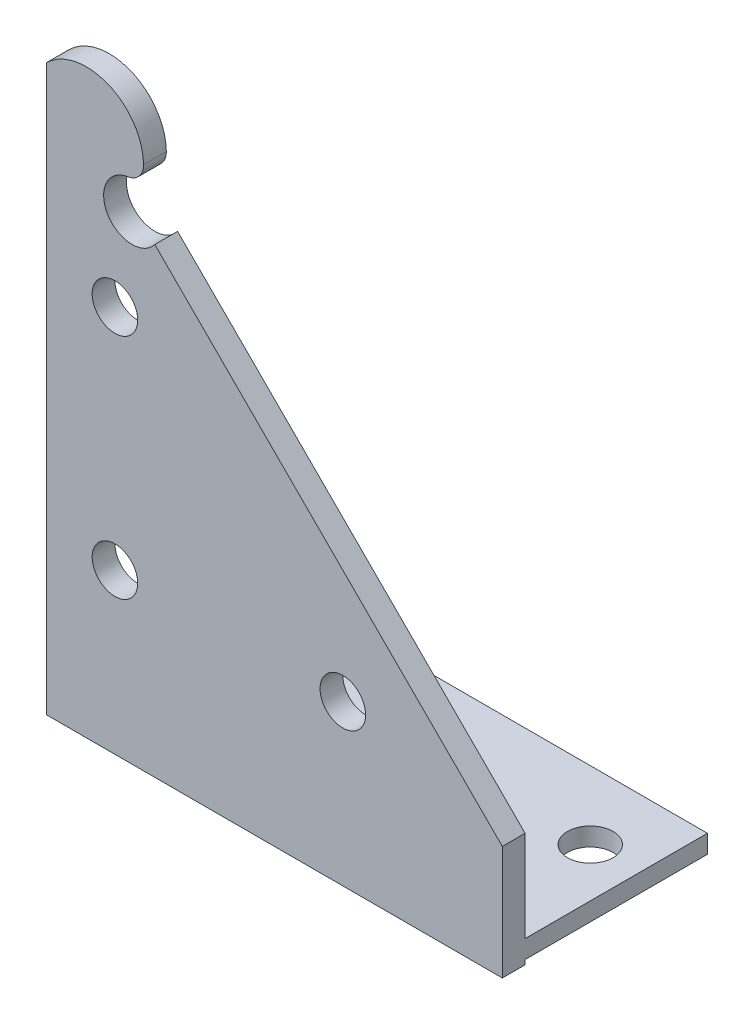
from build123d import *

# Parameters (mm, degrees)
SKETCH1_R           = 3.175
BOSS_EXTRUDE1_DEPTH = 3.175
SKETCH2_W           = 63.5
SKETCH2_H           = 2.54
EXTRUDE_THIN1_DEPTH = 25.4
SKETCH3_R           = 3.175
CUT_EXTRUDE1_DEPTH  = 25.4


with BuildPart() as part:
    # Sketch1 → Boss-Extrude1 (new body)
    with BuildSketch(Plane.XY):
        with BuildLine():
            Line((0, 0), (63.5, 0))
            Line((63.5, 0), (63.5, 15.875))
            Line((63.5, 15.875), (15.080341671, 64.294658329))
            ThreePointArc((15.080341671, 64.294658329), (8.505408108, 64.65221549), (11.339511683, 70.595737627))
            ThreePointArc((11.339511683, 70.595737627), (12.906539417, 71.462906002), (13.511840983, 73.148482141))
            ThreePointArc((13.511840983, 73.148482141), (8.586326617, 80.377738088), (0, 78.705067014))
            Line((0, 78.705067014), (0, 0))
        make_face()
        with Locations((9.525, 22.225)):
            Circle(SKETCH1_R, mode=Mode.SUBTRACT)
        with Locations((9.525, 53.975)):
            Circle(SKETCH1_R, mode=Mode.SUBTRACT)
        with Locations((41.275, 22.225)):
            Circle(SKETCH1_R, mode=Mode.SUBTRACT)
    extrude(amount=BOSS_EXTRUDE1_DEPTH)

    # Sketch2 → Extrude-Thin1 (add)
    with BuildSketch(Plane(origin=(0, 0, 0), x_dir=(-1, 0, 0), z_dir=(0, 0, -1))):
        with Locations((-31.75, 1.905)):
            Rectangle(SKETCH2_W, SKETCH2_H)
    extrude(amount=EXTRUDE_THIN1_DEPTH)

    # Sketch3 → Cut-Extrude1 (cut)
    with BuildSketch(Plane(origin=(0, 3.175, 0), x_dir=(1, 0, 0), z_dir=(0, 1, 0))):
        with Locations(Location((31.75, 12.7, 0), (0, 0, 180))):
            Circle(SKETCH3_R)
        with Locations(Location((9.525, 15.875, 0), (0, 0, 180))):
            Circle(SKETCH3_R)
        with Locations(Location((56.699380445, 15.875, 0), (0, 0, 180))):
            Circle(SKETCH3_R)
    extrude(amount=-CUT_EXTRUDE1_DEPTH, mode=Mode.SUBTRACT)


solid = part.part
